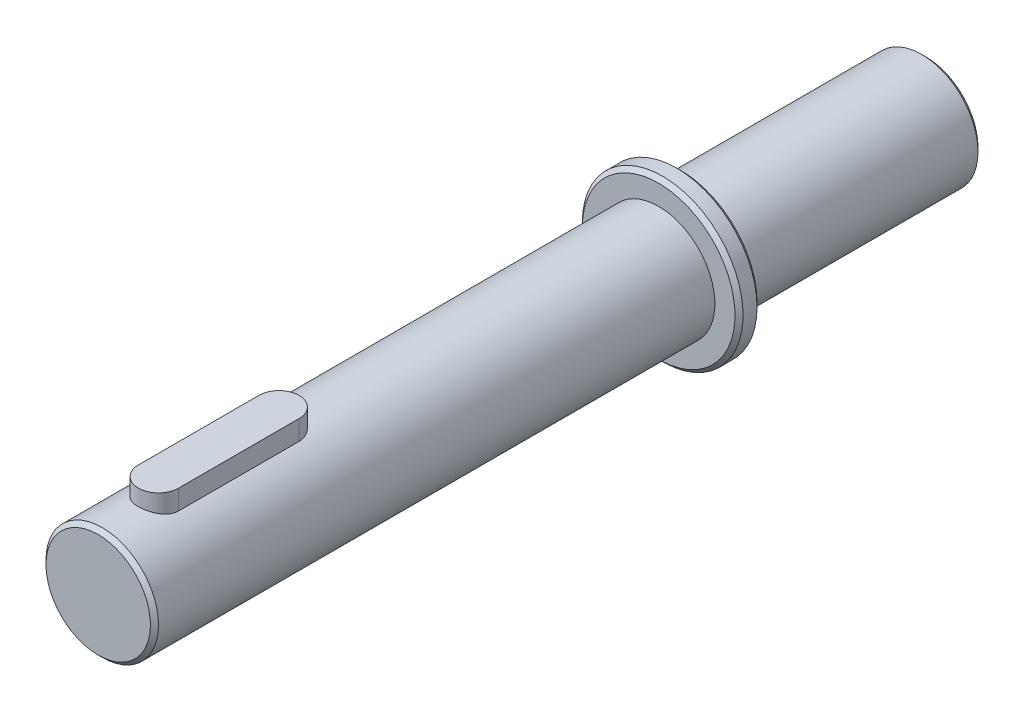
from build123d import *

# Parameters (mm, degrees)
SKICA1_R                     = 7
P_IDAT_VYSUNUT_M1_DEPTH      = 103
SKICA2_W                     = 5
SKICA2_H                     = 2.75
ZKOSEN_1_SIZE                = 0.5
P_IDAT_VYSUNUT_M2_DEPTH      = 2
P_IDAT_VYSUNUT_M2_DEPTH_BACK = 2


with BuildPart() as part:
    # Skica1 → Přidat vysunutím1 (new body)
    with BuildSketch(Plane.XY):
        Circle(SKICA1_R)
    extrude(amount=P_IDAT_VYSUNUT_M1_DEPTH)

    # Skica2 → Rotovat1 (revolve)
    with BuildSketch(Plane(origin=(0, 0, 0), x_dir=(1, 0, 0), z_dir=(0, 1, 0))):
        with Locations((7.5, -31.875)):
            Rectangle(SKICA2_W, SKICA2_H)
    revolve(axis=Axis((0, 0, 0), (0, 0, 1)))

    # Zkosení1
    zkosen_1_edges = [part.edges().sort_by_distance(p)[0] for p in [
        (-7, 0, 103),
        (-7, 0, 0),
        (-10, 0, 30.5),
        (-10, 0, 33.25),
    ]]
    chamfer(zkosen_1_edges, length=ZKOSEN_1_SIZE)

    # Skica5 → Přidat vysunutím2 (add, two sides: drawn at the far end of the back side and taken through both)
    with BuildSketch(Plane(origin=(0, 7, 0), x_dir=(1, 0, 0), z_dir=(0, 1, 0)).offset(-P_IDAT_VYSUNUT_M2_DEPTH_BACK)):
        with BuildLine():
            Line((2.5, -80.5), (2.5, -95.5))
            ThreePointArc((2.5, -95.5), (0, -98), (-2.5, -95.5))
            Line((-2.5, -95.5), (-2.5, -80.5))
            ThreePointArc((-2.5, -80.5), (0, -78), (2.5, -80.5))
        make_face()
    extrude(amount=P_IDAT_VYSUNUT_M2_DEPTH + P_IDAT_VYSUNUT_M2_DEPTH_BACK)


solid = part.part
